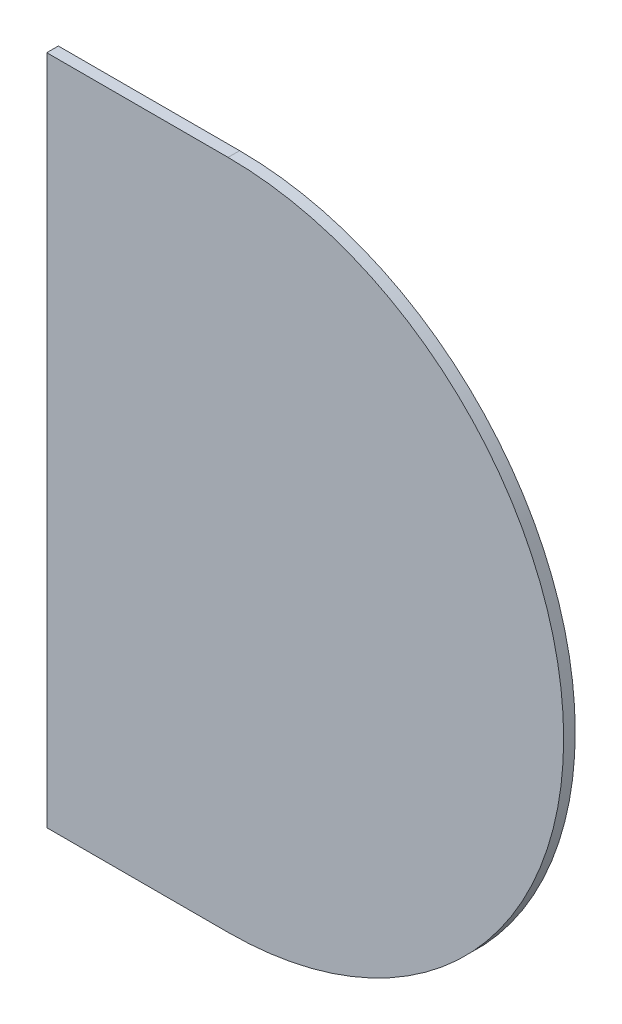
from build123d import *

# Parameters (mm, degrees)
BOSS_EXTRUDE1_DEPTH = 30


with BuildPart() as part:
    # Sketch1 → Boss-Extrude1 (new body)
    with BuildSketch(Plane.XY):
        with BuildLine():
            Line((0, 0), (470, 0))
            ThreePointArc((470, 0), (1340, 870), (470, 1740))
            Line((470, 1740), (0, 1740))
            Line((0, 1740), (0, 0))
        make_face()
    extrude(amount=BOSS_EXTRUDE1_DEPTH)


solid = part.part
